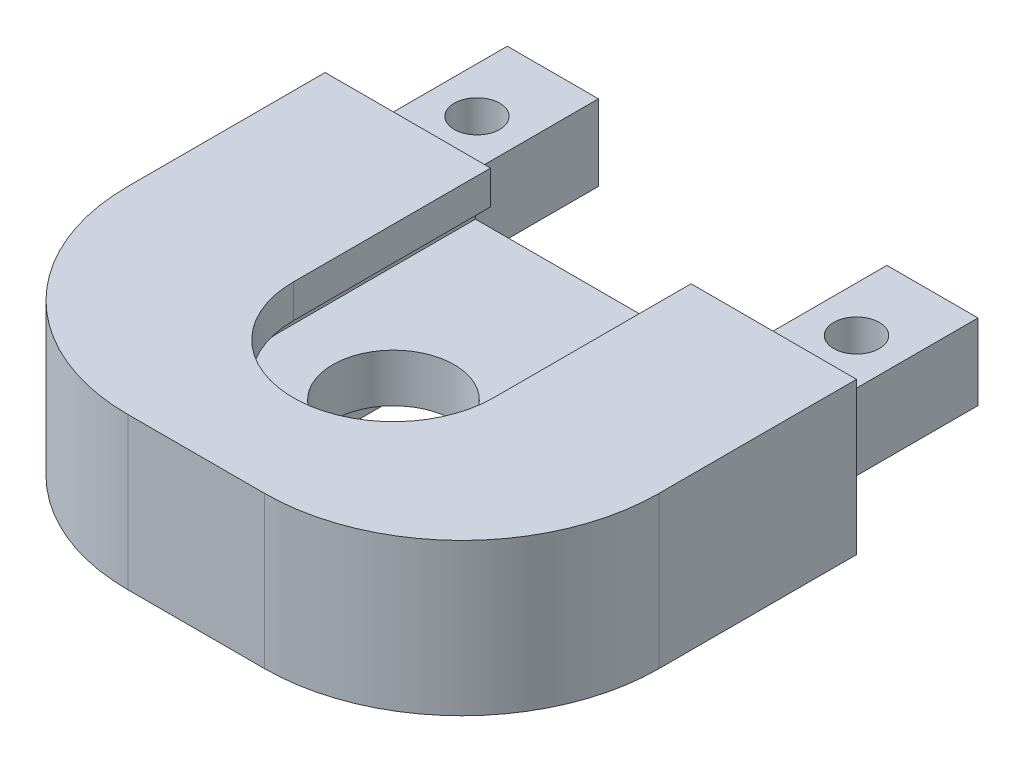
from build123d import *

# Parameters (mm, degrees)
SKETCH1_R           = 1.5
BOSS_EXTRUDE1_DEPTH = 5
SKETCH2_W           = 35
SKETCH2_H           = 2.5
BOSS_EXTRUDE2_DEPTH = 26
FILLET1_R           = 13
CUT_EXTRUDE1_START  = -13
CUT_EXTRUDE1_DEPTH  = 56.676105727
SKETCH4_R           = 7.6
CUT_EXTRUDE2_DEPTH  = 1.2
SKETCH5_R           = 6.6
CUT_EXTRUDE3_DEPTH  = 50.27874954
CUT_EXTRUDE4_START  = 1.2
SKETCH6_R           = 7.6
CUT_EXTRUDE4_DEPTH  = 1.2
SKETCH7_R           = 6.6
CUT_EXTRUDE5_DEPTH  = 50.27874954
SKETCH8_R           = 4
CUT_EXTRUDE6_DEPTH  = 50.27874954


with BuildPart() as part:
    # Sketch1 → Boss-Extrude1 (new body)
    with BuildSketch(Plane(origin=(0, 0, 0), x_dir=(1, 0, 0), z_dir=(0, 1, 0))):
        Polygon((0, 0), (6, 0), (6, -10), (25, -10), (25, 0), (31, 0), (31, -10), (33, -10), (33, -36), (-2, -36), (-2, -10), (0, -10), align=None)
        with Locations(Location((3, -5, 0), (0, 0, 270))):
            Circle(SKETCH1_R, mode=Mode.SUBTRACT)
        with Locations(Location((28, -5, 0), (0, 0, 90))):
            Circle(SKETCH1_R, mode=Mode.SUBTRACT)
    extrude(amount=BOSS_EXTRUDE1_DEPTH)

    # Sketch2 → Boss-Extrude2 (add)
    with BuildSketch(Plane.XY.offset(36)):
        with Locations((15.5, 6.25)):
            Rectangle(SKETCH2_W, SKETCH2_H)
        with Locations((15.5, -1.25)):
            Rectangle(SKETCH2_W, SKETCH2_H)
    extrude(amount=-BOSS_EXTRUDE2_DEPTH)

    # Fillet1
    fillet1_edges = [part.edges().sort_by_distance(p)[0] for p in [
        (33, 2.5, 36),
        (-2, 2.5, 36),
    ]]
    fillet(fillet1_edges, radius=FILLET1_R)

    # Sketch3 → Cut-Extrude1 (cut)
    with BuildSketch(Plane(origin=(0, 0, 10), x_dir=(-1, 0, 0), z_dir=(0, 0, -1)).offset(CUT_EXTRUDE1_START)):
        Polygon((-22.1, 7.5), (-22.1, 5.2875), (-23.1, 5.2875), (-23.1, 4.0875), (-15.5, 4.0875), (-7.9, 4.0875), (-7.9, 5.2875), (-8.9, 5.2875), (-8.9, 7.5), align=None)
    cut_extrude1 = extrude(amount=CUT_EXTRUDE1_DEPTH, mode=Mode.SUBTRACT)

    # Sketch4 → Cut-Extrude2 (cut)
    with BuildSketch(Plane(origin=(0, 4.0875, 0), x_dir=(1, 0, 0), z_dir=(0, 1, 0))):
        with Locations((15.5, -23)):
            Circle(SKETCH4_R)
    extrude(amount=CUT_EXTRUDE2_DEPTH, mode=Mode.SUBTRACT)

    # Sketch5 → Cut-Extrude3 (cut, through all)
    with BuildSketch(Plane(origin=(0, 4.0875, 0), x_dir=(1, 0, 0), z_dir=(0, 1, 0))):
        with Locations((15.5, -23)):
            Circle(SKETCH5_R)
    extrude(amount=CUT_EXTRUDE3_DEPTH, mode=Mode.SUBTRACT)

    # Mirror1: Cut-Extrude1 across plane
    add(cut_extrude1.mirror(Plane(origin=(0, 2.5, 0), x_dir=(0, 0, 1), z_dir=(0, -1, 0))), mode=Mode.SUBTRACT)

    # Sketch6 → Cut-Extrude4 (cut)
    with BuildSketch(Plane.XZ.offset(-0.9125).offset(CUT_EXTRUDE4_START)):
        with Locations((15.5, 23)):
            Circle(SKETCH6_R)
    extrude(amount=-CUT_EXTRUDE4_DEPTH, mode=Mode.SUBTRACT)

    # Sketch7 → Cut-Extrude5 (cut, through all)
    with BuildSketch(Plane.XZ.offset(-0.9125)):
        with Locations((15.5, 23)):
            Circle(SKETCH7_R)
    extrude(amount=CUT_EXTRUDE5_DEPTH, mode=Mode.SUBTRACT)

    # Sketch8 → Cut-Extrude6 (cut, through all)
    with BuildSketch(Plane(origin=(0, 4.0875, 0), x_dir=(1, 0, 0), z_dir=(0, 1, 0))):
        with Locations(Location((15.5, -23, 0), (0, 0, 270))):
            Circle(SKETCH8_R)
    extrude(amount=-CUT_EXTRUDE6_DEPTH, mode=Mode.SUBTRACT)


solid = part.part
